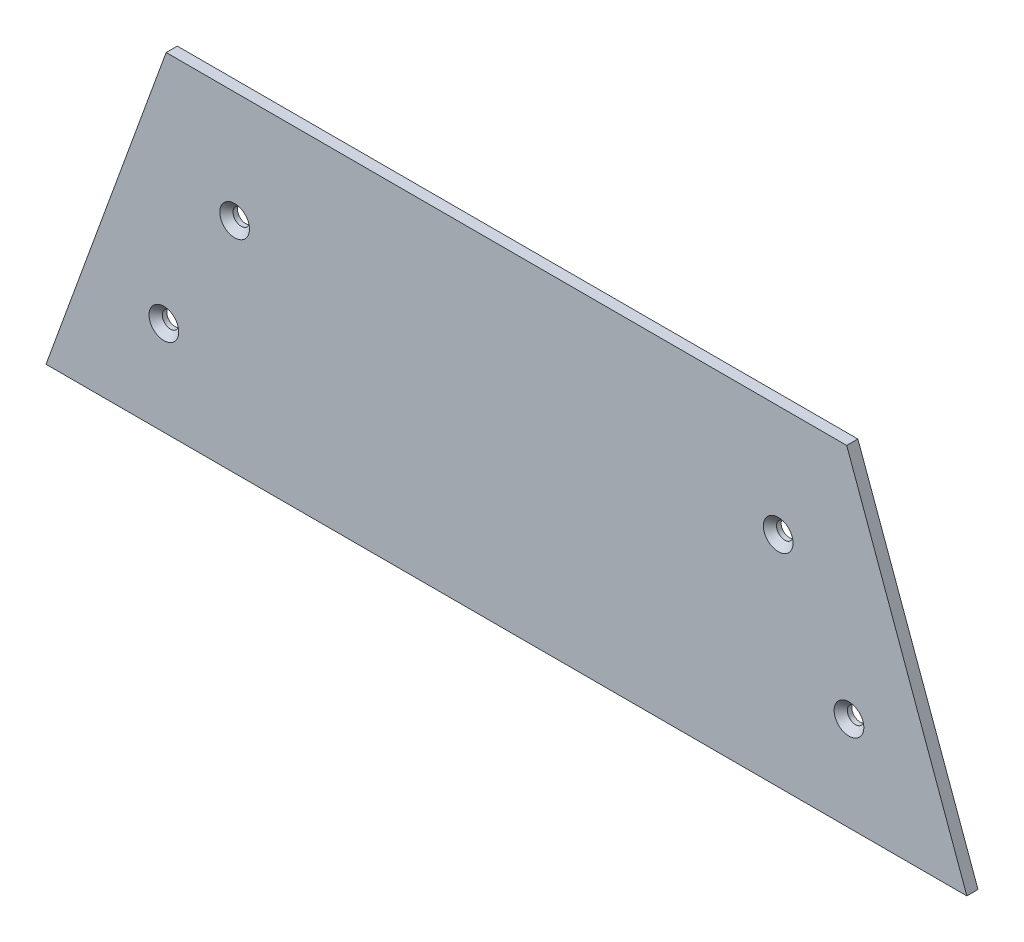
from build123d import *

# Parameters (mm, degrees)
SKETCH1_W                = 195.277
SKETCH1_H                = 70
MAIN_DEPTH               = 1.1811
ANGLECUTS_REACH          = 105.749
BRACKETHOLES_D           = 3.5
BRACKETHOLES_DEPTH       = 5
BRACKETHOLES_CSINK_D     = 6.3
BRACKETHOLES_CSINK_ANGLE = 90


with BuildPart() as part:
    # Sketch1 → Main (new, symmetric)
    with BuildSketch(Plane.XY):
        Rectangle(SKETCH1_W, SKETCH1_H)
    extrude(amount=MAIN_DEPTH, both=True)

    # Sketch2 → AngleCuts (cut, up to next)
    with BuildSketch(Plane.XY.offset(1.1811), mode=Mode.PRIVATE) as anglecuts_sk1:
        Polygon((-97.6385, 35), (-72.160583601, 35), (-97.6385, -35), align=None)
    anglecuts_tool1 = extrude(anglecuts_sk1.sketch, amount=-ANGLECUTS_REACH, mode=Mode.PRIVATE) & part.part
    # Sketch2 → AngleCuts (cut, up to next)
    with BuildSketch(Plane.XY.offset(1.1811), mode=Mode.PRIVATE) as anglecuts_sk2:
        Polygon((97.6385, 35), (97.6385, -35), (72.160583601, 35), align=None)
    anglecuts_tool2 = extrude(anglecuts_sk2.sketch, amount=-ANGLECUTS_REACH, mode=Mode.PRIVATE) & part.part
    add(anglecuts_tool1.solids().sort_by_distance((-89.145861, 11.666667, 1.1811))[0], mode=Mode.SUBTRACT)
    add(anglecuts_tool2.solids().sort_by_distance((89.145861, 11.666667, 1.1811))[0], mode=Mode.SUBTRACT)

    # BracketHoles
    with Locations(Plane.XY.offset(1.1811)):
        with Locations((-72.6378, -15), (-57.6378, 11.3815573), (57.6378, 11.3815573), (72.6378, -15)):
            CounterSinkHole(BRACKETHOLES_D / 2, BRACKETHOLES_CSINK_D / 2, depth=BRACKETHOLES_DEPTH, counter_sink_angle=BRACKETHOLES_CSINK_ANGLE)


solid = part.part
